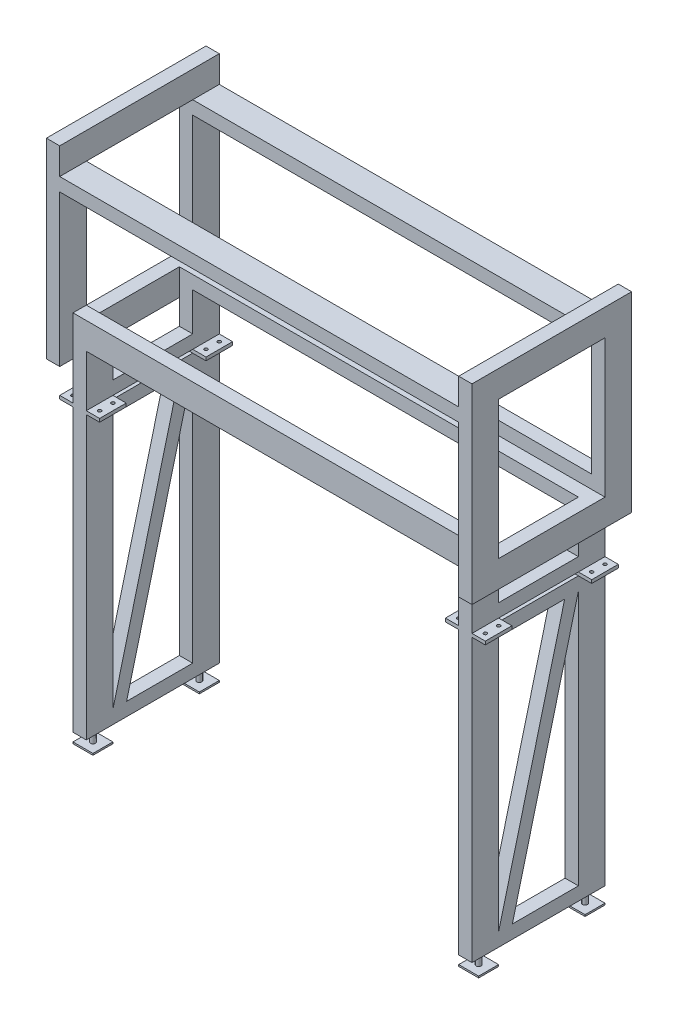
from build123d import *

# Parameters (mm, degrees)
SKETCH1_W            = 609.6
SKETCH1_H            = 730.25
SKETCH1_W_2          = 406.4
SKETCH1_H_2          = 527.05
BOSS_EXTRUDE1_DEPTH  = 50.8
SKETCH2_W            = 101.6
SKETCH2_H            = 50.8
BOSS_EXTRUDE2_DEPTH  = 1524
SKETCH3_W            = 304.8
SKETCH3_H            = 12.7
BOSS_EXTRUDE3_DEPTH  = 50.8
SKETCH4_W            = 101.6
SKETCH4_H            = 12.7
BOSS_EXTRUDE4_DEPTH  = 101.6
SKETCH4_2_W          = 101.6
SKETCH4_2_H          = 12.7
BOSS_EXTRUDE5_DEPTH  = 50.8
SKETCH5_W            = 609.6
SKETCH5_H            = 730.25
SKETCH5_W_2          = 406.4
SKETCH5_H_2          = 527.05
BOSS_EXTRUDE6_DEPTH  = 50.8
SKETCH7_W            = 304.8
SKETCH7_H            = 12.7
BOSS_EXTRUDE7_DEPTH  = 50.8
SKETCH8_W            = 101.6
SKETCH8_H            = 12.7
BOSS_EXTRUDE8_DEPTH  = 50.8
SKETCH8_2_W          = 101.6
SKETCH8_2_H          = 12.7
BOSS_EXTRUDE9_DEPTH  = 101.6
SKETCH9_R            = 6.35
CUT_EXTRUDE1_DEPTH   = 12.7
SKETCH10_R           = 9.525
BOSS_EXTRUDE10_DEPTH = 50.8
SKETCH10_3_W         = 76.2
SKETCH10_3_H         = 76.2
SKETCH10_3_R         = 9.525
BOSS_EXTRUDE11_DEPTH = 6.35


with BuildPart() as part:
    # Sketch1 → Boss-Extrude1 (new body)
    with BuildSketch(Plane(origin=(-762, 0, 0), x_dir=(0, 0, -1), z_dir=(1, 0, 0))):
        with Locations((0, 263.525)):
            Rectangle(SKETCH1_W, SKETCH1_H)
        with Locations((0, 263.525)):
            Rectangle(SKETCH1_W_2, SKETCH1_H_2, mode=Mode.SUBTRACT)
    extrude(amount=-BOSS_EXTRUDE1_DEPTH)

    # Sketch2 → Boss-Extrude2 (add)
    with BuildSketch(Plane(origin=(-762, 0, 0), x_dir=(0, 0, -1), z_dir=(1, 0, 0))):
        Polygon((-203.2, 50.8), (-203.2, 0), (-152.4, 0), (-152.4, -50.8), (-254, -50.8), (-254, 50.8), align=None)
        Polygon((203.2, 50.8), (203.2, 0), (152.4, 0), (152.4, -50.8), (254, -50.8), (254, 50.8), align=None)
        with Locations((-254, 501.65)):
            Rectangle(SKETCH2_W, SKETCH2_H)
        with Locations((254, 501.65)):
            Rectangle(SKETCH2_W, SKETCH2_H)
    extrude(amount=BOSS_EXTRUDE2_DEPTH)

    # Sketch3 → Boss-Extrude3 (add)
    with BuildSketch(Plane(origin=(-762, 0, 0), x_dir=(0, 0, -1), z_dir=(1, 0, 0))):
        Polygon((-152.4, -50.8), (-254, -50.8), (-254, -1336.675), (254, -1336.675), (254, -50.8), (152.4, -50.8), (152.4, -196.85), (-152.4, -196.85), align=None)
        with Locations((0, -254)):
            Rectangle(SKETCH3_W, SKETCH3_H, mode=Mode.SUBTRACT)
        Polygon((-152.4, -1285.875), (-152.4, -311.15), (99.92547286, -311.15), align=None, mode=Mode.SUBTRACT)
        Polygon((152.4, -1285.875), (-99.92547286, -1285.875), (152.4, -311.15), align=None, mode=Mode.SUBTRACT)
    extrude(amount=BOSS_EXTRUDE3_DEPTH)

    # Sketch4 → Boss-Extrude4 (add)
    with BuildSketch(Plane(origin=(-762, 0, 0), x_dir=(0, 0, -1), z_dir=(1, 0, 0))):
        with Locations((-203.2, -254)):
            Rectangle(SKETCH4_W, SKETCH4_H)
        with Locations((203.2, -254)):
            Rectangle(SKETCH4_W, SKETCH4_H)
    extrude(amount=BOSS_EXTRUDE4_DEPTH)

    # Sketch4<2> → Boss-Extrude5 (add)
    with BuildSketch(Plane(origin=(-762, 0, 0), x_dir=(0, 0, -1), z_dir=(1, 0, 0))):
        with Locations((-203.2, -254)):
            Rectangle(SKETCH4_2_W, SKETCH4_2_H)
        with Locations((203.2, -254)):
            Rectangle(SKETCH4_2_W, SKETCH4_2_H)
    extrude(amount=-BOSS_EXTRUDE5_DEPTH)

    # Sketch5 → Boss-Extrude6 (add)
    with BuildSketch(Plane(origin=(762, 0, 0), x_dir=(0, 0, -1), z_dir=(1, 0, 0))):
        with Locations((0, 263.525)):
            Rectangle(SKETCH5_W, SKETCH5_H)
        with Locations((0, 263.525)):
            Rectangle(SKETCH5_W_2, SKETCH5_H_2, mode=Mode.SUBTRACT)
    extrude(amount=BOSS_EXTRUDE6_DEPTH)

    # Sketch7 → Boss-Extrude7 (add)
    with BuildSketch(Plane(origin=(762, 0, 0), x_dir=(0, 0, -1), z_dir=(1, 0, 0))):
        Polygon((-152.4, -50.8), (-254, -50.8), (-254, -1336.675), (254, -1336.675), (254, -50.8), (152.4, -50.8), (152.4, -196.85), (-152.4, -196.85), align=None)
        with Locations((0, -254)):
            Rectangle(SKETCH7_W, SKETCH7_H, mode=Mode.SUBTRACT)
        Polygon((-152.4, -1285.875), (-152.4, -311.15), (99.92547286, -311.15), align=None, mode=Mode.SUBTRACT)
        Polygon((152.4, -1285.875), (-99.92547286, -1285.875), (152.4, -311.15), align=None, mode=Mode.SUBTRACT)
    extrude(amount=-BOSS_EXTRUDE7_DEPTH)

    # Sketch8 → Boss-Extrude8 (add)
    with BuildSketch(Plane(origin=(762, 0, 0), x_dir=(0, 0, -1), z_dir=(1, 0, 0))):
        with Locations((-203.2, -254)):
            Rectangle(SKETCH8_W, SKETCH8_H)
        with Locations((203.2, -254)):
            Rectangle(SKETCH8_W, SKETCH8_H)
    extrude(amount=BOSS_EXTRUDE8_DEPTH)

    # Sketch8<2> → Boss-Extrude9 (add)
    with BuildSketch(Plane(origin=(762, 0, 0), x_dir=(0, 0, -1), z_dir=(1, 0, 0))):
        with Locations((-203.2, -254)):
            Rectangle(SKETCH8_2_W, SKETCH8_2_H)
        with Locations((203.2, -254)):
            Rectangle(SKETCH8_2_W, SKETCH8_2_H)
    extrude(amount=-BOSS_EXTRUDE9_DEPTH)

    # Sketch9 → Cut-Extrude1 (cut)
    with BuildSketch(Plane(origin=(0, -247.65, 0), x_dir=(1, 0, 0), z_dir=(0, 1, 0))):
        with Locations((-787.4, 228.6)):
            Circle(SKETCH9_R)
        with Locations((-787.4, 177.8)):
            Circle(SKETCH9_R)
        with Locations((-685.8, 177.8)):
            Circle(SKETCH9_R)
        with Locations((-685.8, 228.6)):
            Circle(SKETCH9_R)
        with Locations((-787.4, -177.8)):
            Circle(SKETCH9_R)
        with Locations((-787.4, -228.6)):
            Circle(SKETCH9_R)
        with Locations((-685.8, -177.8)):
            Circle(SKETCH9_R)
        with Locations((-685.8, -228.6)):
            Circle(SKETCH9_R)
        with Locations((685.8, 228.6)):
            Circle(SKETCH9_R)
        with Locations((685.8, 177.8)):
            Circle(SKETCH9_R)
        with Locations((787.4, 228.6)):
            Circle(SKETCH9_R)
        with Locations((787.4, 177.8)):
            Circle(SKETCH9_R)
        with Locations((685.8, -177.8)):
            Circle(SKETCH9_R)
        with Locations((685.8, -228.6)):
            Circle(SKETCH9_R)
        with Locations((787.4, -177.8)):
            Circle(SKETCH9_R)
        with Locations((787.4, -228.6)):
            Circle(SKETCH9_R)
    extrude(amount=-CUT_EXTRUDE1_DEPTH, mode=Mode.SUBTRACT)

    # Sketch10 → Boss-Extrude10 (add)
    with BuildSketch(Plane(origin=(0, -1387.475, 0), x_dir=(-1, 0, 0), z_dir=(0, -1, 0))):
        with Locations((736.6, -203.2)):
            Circle(SKETCH10_R)
        with Locations((-736.6, -203.2)):
            Circle(SKETCH10_R)
        with Locations((-736.6, 203.2)):
            Circle(SKETCH10_R)
        with Locations((736.6, 203.2)):
            Circle(SKETCH10_R)
    extrude(amount=-BOSS_EXTRUDE10_DEPTH)

    # Sketch10<3> → Boss-Extrude11 (add)
    # profile 1 of 4: a face of its own
    with BuildSketch(Plane(origin=(0, -1387.475, 0), x_dir=(-1, 0, 0), z_dir=(0, -1, 0))):
        with Locations((-736.6, -203.2)):
            Rectangle(SKETCH10_3_W, SKETCH10_3_H)
        with Locations((-736.6, -203.2)):
            Circle(SKETCH10_3_R, mode=Mode.SUBTRACT)
    # profile 2 of 4: a face of its own
    with BuildSketch(Plane(origin=(0, -1387.475, 0), x_dir=(-1, 0, 0), z_dir=(0, -1, 0))):
        with Locations((736.6, -203.2)):
            Rectangle(SKETCH10_3_W, SKETCH10_3_H)
        with Locations((736.6, -203.2)):
            Circle(SKETCH10_3_R, mode=Mode.SUBTRACT)
    # profile 3 of 4: a face of its own
    with BuildSketch(Plane(origin=(0, -1387.475, 0), x_dir=(-1, 0, 0), z_dir=(0, -1, 0))):
        with Locations((-736.6, 203.2)):
            Rectangle(SKETCH10_3_W, SKETCH10_3_H)
        with Locations((-736.6, 203.2)):
            Circle(SKETCH10_3_R, mode=Mode.SUBTRACT)
    # profile 4 of 4: a face of its own
    with BuildSketch(Plane(origin=(0, -1387.475, 0), x_dir=(-1, 0, 0), z_dir=(0, -1, 0))):
        with Locations((736.6, 203.2)):
            Rectangle(SKETCH10_3_W, SKETCH10_3_H)
        with Locations((736.6, 203.2)):
            Circle(SKETCH10_3_R, mode=Mode.SUBTRACT)
    extrude(amount=-BOSS_EXTRUDE11_DEPTH)


solid = part.part
